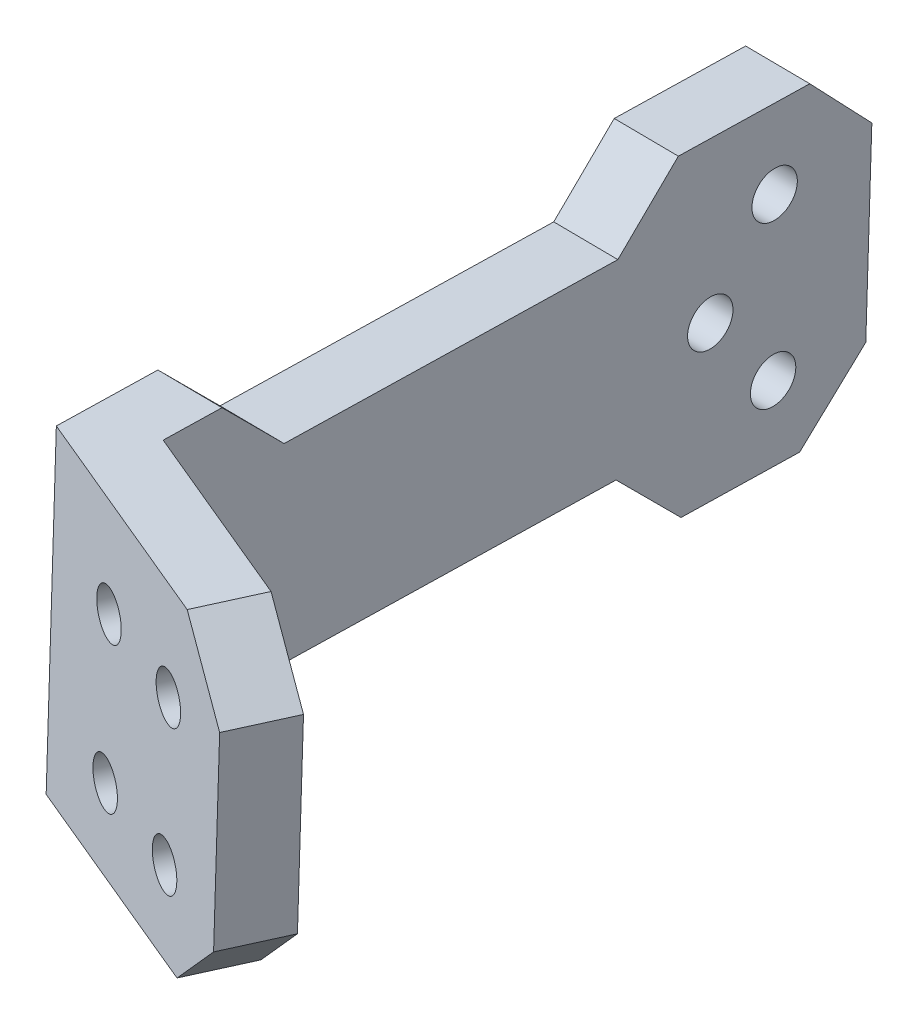
from build123d import *

# Parameters (mm, degrees)
BOSS_EXTRUDE1_DEPTH = 31.393669496
SKETCH2_R           = 2.2479
CUT_EXTRUDE1_DEPTH  = 25.4
SKETCH3_R           = 2.2479
CUT_EXTRUDE2_DEPTH  = 125.422963879
CHAMFER1_SIZE       = 6.35
CUT_EXTRUDE3_DEPTH  = 125.298756427


with BuildPart() as part:
    # Sketch1 → Boss-Extrude1 (new body)
    with BuildSketch(Plane(origin=(0.6776252, 71.712515869, -1.625106612), x_dir=(0.9999553823033352, -0.009443918743859435, 0.00021401249988442188), z_dir=(0.00944634334495239, 0.9996987228929893, -0.022654581071729834))):
        Polygon((-80.390891149, -86.321957013), (-52.305186001, -98.029402941), (-49.86197702, -92.168240098), (-74.040891149, -82.089328841), (-74.040891149, -11.700797327), (-80.390891149, -11.700797327), align=None)
    extrude(amount=-BOSS_EXTRUDE1_DEPTH)

    # Sketch2 → Cut-Extrude1 (cut)
    with BuildSketch(Plane(origin=(-40.112117335, 2.559018494, 96.198410426), x_dir=(-0.9230249263960171, -0.010231031804124746, -0.38460409675385737), z_dir=(0.3847401528975465, -0.024545130802794784, -0.9226985159315292))):
        with Locations(Location((19.175632023, 62.560327637, 0), (0, 0, 0.586381839))):
            Circle(SKETCH2_R)
        with Locations(Location((19.175632023, 48.379344504, 0), (0, 0, 0.586381839))):
            Circle(SKETCH2_R)
        with Locations(Location((30.098530107, 62.672119688, 0), (0, 0, 0.586381839))):
            Circle(SKETCH2_R)
        with Locations(Location((30.098530107, 48.379344504, 0), (0, 0, 0.586381839))):
            Circle(SKETCH2_R)
    extrude(amount=-CUT_EXTRUDE1_DEPTH, mode=Mode.SUBTRACT)

    # Sketch3 → Cut-Extrude2 (cut, through all)
    with BuildSketch(Plane(origin=(-74.037587615, 0.69923616, -0.015845676), x_dir=(0.0002140029560402251, -2.0211167053616923e-06, -0.9999999770993246), z_dir=(0.9999553823033352, -0.009443918743859442, 0.0002140124998842152))):
        with Locations(Location((-19.828022513, 48.267249559, 0), (0, 0, 90))):
            Circle(SKETCH3_R)
        with Locations(Location((-19.828022513, 64.308726004, 0), (0, 0, 90))):
            Circle(SKETCH3_R)
        with Locations(Location((-26.123020247, 56.386607545, 0), (0, 0, 90))):
            Circle(SKETCH3_R)
    extrude(amount=-CUT_EXTRUDE2_DEPTH, mode=Mode.SUBTRACT)

    # Chamfer1
    chamfer1_edges = [part.edges().sort_by_distance(p)[0] for p in [
        (-50.700232459, 42.965253851, 94.149583717),
        (-76.831376135, 41.322613658, 10.767372726),
        (-76.534820754, 72.70682496, 10.056162295),
        (-50.403677078, 74.349465153, 93.438373286),
    ]]
    chamfer(chamfer1_edges, length=CHAMFER1_SIZE)

    # Sketch4 → Cut-Extrude3 (cut, through all)
    with BuildSketch(Plane(origin=(-74.037587615, 0.69923616, -0.015845676), x_dir=(0.00021400295604023366, -2.0211167053617732e-06, -0.9999999770993246), z_dir=(0.9999553823033352, -0.00944391874385944, 0.00021401249988422377))):
        Polygon((-74.619229168, 73.443444245), (-68.413380882, 67.237595959), (-35.367046454, 66.488752891), (-29.436220039, 72.419579306), align=None)
        Polygon((-74.619229168, 42.04171556), (-68.413380882, 48.247563846), (-35.367046454, 47.498720777), (-28.873423095, 41.005097418), align=None)
    extrude(amount=-CUT_EXTRUDE3_DEPTH, mode=Mode.SUBTRACT)


solid = part.part
